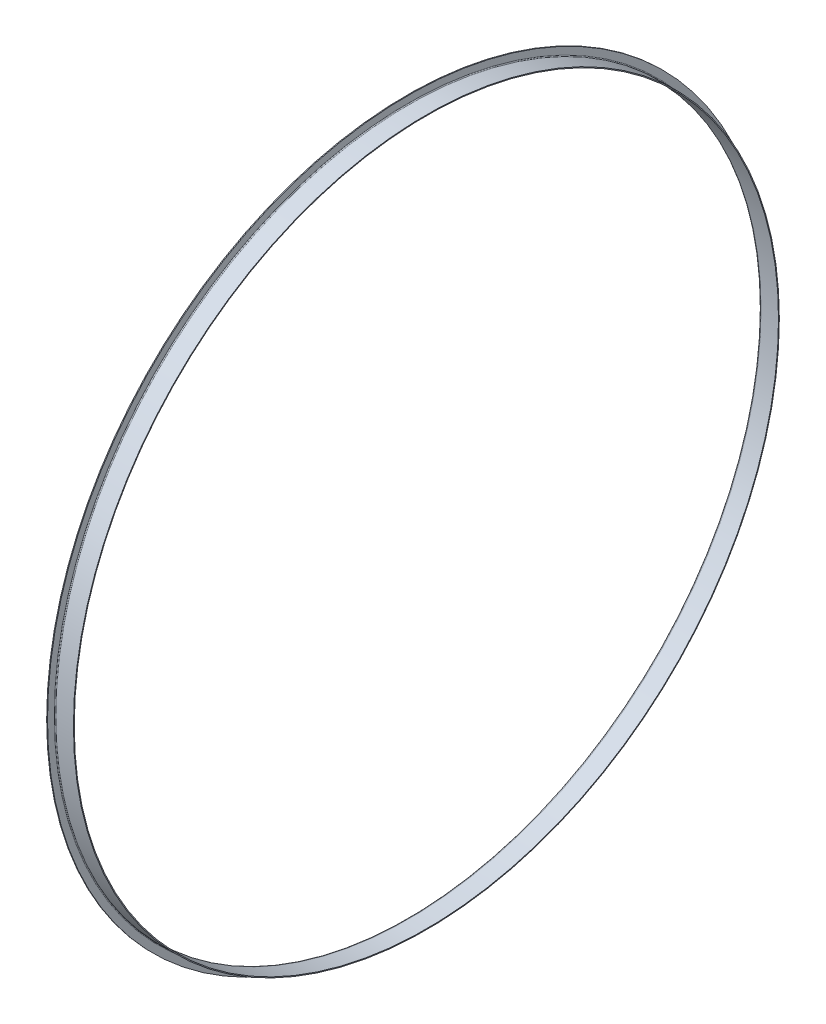
from build123d import *


with BuildPart() as part:
    # Sketch1 → Revolve1 (revolve)
    with BuildSketch(Plane.XY, mode=Mode.PRIVATE) as revolve1_sk:
        with BuildLine():
            Line((12.43902439, 115.402071406), (-49.56097561, 115.402071406))
            ThreePointArc((-49.56097561, 115.402071406), (-53.803616297, 117.159430719), (-55.56097561, 121.402071406))
            Line((-55.56097561, 121.402071406), (-55.56097561, 145.402071406))
            Line((-55.56097561, 145.402071406), (-52.56097561, 145.402071406))
            Line((-52.56097561, 145.402071406), (-52.56097561, 121.402071406))
            ThreePointArc((-52.56097561, 121.402071406), (-51.682295953, 119.280751062), (-49.56097561, 118.402071406))
            Line((-49.56097561, 118.402071406), (12.43902439, 118.402071406))
            Line((12.43902439, 118.402071406), (12.43902439, 115.402071406))
        make_face()
    revolve(revolve1_sk.sketch.rotate(Axis((-55.56097561, -1134.597928594, 0), (1, 0, 0)), 90), axis=Axis((-55.56097561, -1134.597928594, 0), (1, 0, 0)))


solid = part.part
